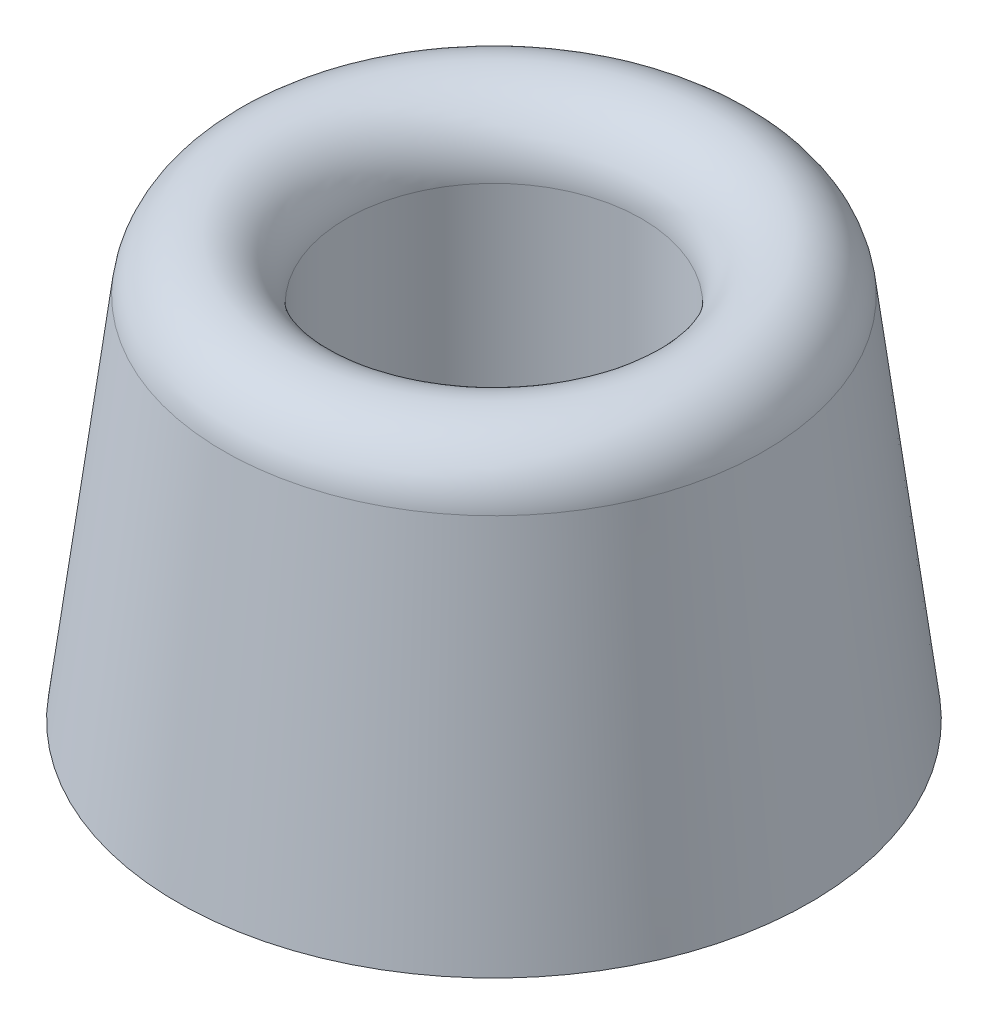
from build123d import *


with BuildPart() as part:
    # Sketch2 → Revolve1 (revolve)
    with BuildSketch(Plane.XY):
        with BuildLine():
            Line((-5.55625, 4.7625), (-2.778125, 4.7625))
            Line((-2.778125, 4.7625), (-2.778125, 0))
            Line((-2.778125, 0), (-11.90625, 0))
            Line((-11.90625, 0), (-10.175763622, 13.843891025))
            ThreePointArc((-10.175763622, 13.843891025), (-7.730880816, 15.870519331), (-5.55625, 13.556290509))
            Line((-5.55625, 13.556290509), (-5.55625, 4.7625))
        make_face()
    revolve(axis=Axis((0, 0, 0), (0, 1, 0)))


solid = part.part
